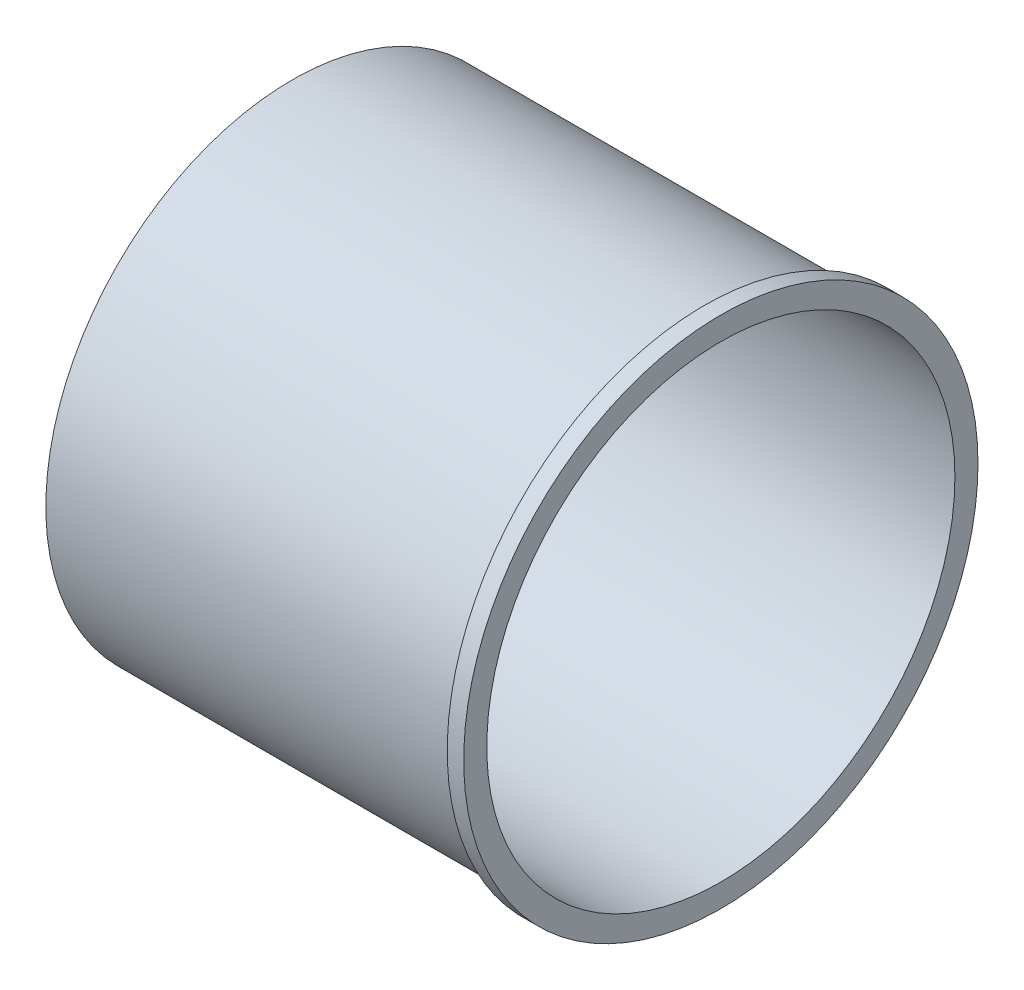
from build123d import *

# Parameters (mm, degrees)
SKETCH1_R           = 37.973
SKETCH1_R_2         = 36.068
BOSS_EXTRUDE1_DEPTH = 63.5
SKETCH2_R           = 39.624
SKETCH2_R_2         = 36.068
BOSS_EXTRUDE2_DEPTH = 2.54


with BuildPart() as part:
    # Sketch1 → Boss-Extrude1 (new body)
    with BuildSketch(Plane.YZ):
        with Locations(Location((0, 0, 0), (0, 0, 270))):
            Circle(SKETCH1_R)
        with Locations(Location((0, 0, 0), (0, 0, 270))):
            Circle(SKETCH1_R_2, mode=Mode.SUBTRACT)
    extrude(amount=BOSS_EXTRUDE1_DEPTH)

    # Sketch2 → Boss-Extrude2 (add)
    with BuildSketch(Plane.YZ.offset(63.5)):
        with Locations(Location((0, 0, 0), (0, 0, 270))):
            Circle(SKETCH2_R)
        with Locations(Location((0, 0, 0), (0, 0, 270))):
            Circle(SKETCH2_R_2, mode=Mode.SUBTRACT)
    extrude(amount=BOSS_EXTRUDE2_DEPTH)


solid = part.part
